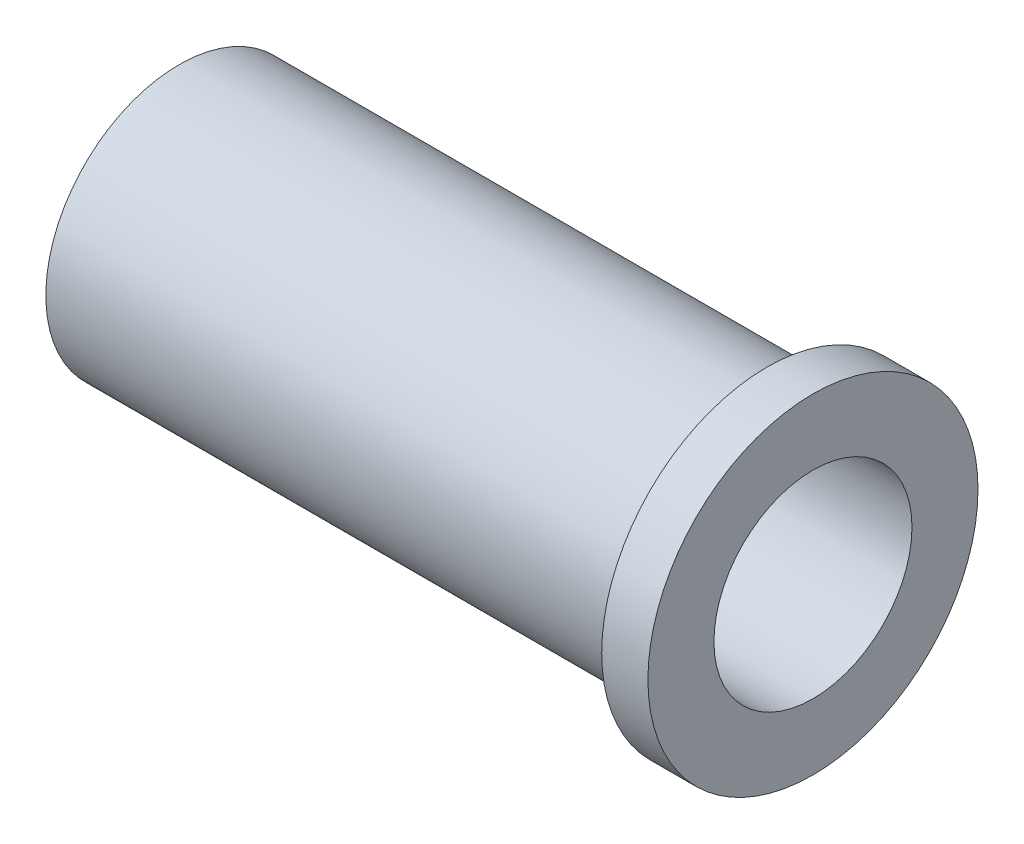
from build123d import *

# Parameters (mm, degrees)
SKETCH1_R           = 10.1
SKETCH1_R_2         = 7.5
BOSS_EXTRUDE1_DEPTH = 48
BOSS_EXTRUDE2_START = -3.5
SKETCH2_R           = 12.5
SKETCH2_R_2         = 10.1
BOSS_EXTRUDE2_DEPTH = 3.5


with BuildPart() as part:
    # Sketch1 → Boss-Extrude1 (new body)
    with BuildSketch(Plane(origin=(0, 0, 0), x_dir=(0, 0, -1), z_dir=(1, 0, 0))):
        Circle(SKETCH1_R)
        Circle(SKETCH1_R_2, mode=Mode.SUBTRACT)
    extrude(amount=BOSS_EXTRUDE1_DEPTH)

    # Sketch2 → Boss-Extrude2 (add)
    with BuildSketch(Plane(origin=(48, 0, 0), x_dir=(0, 0, -1), z_dir=(1, 0, 0)).offset(BOSS_EXTRUDE2_START)):
        Circle(SKETCH2_R)
        Circle(SKETCH2_R_2, mode=Mode.SUBTRACT)
    extrude(amount=BOSS_EXTRUDE2_DEPTH)


solid = part.part
